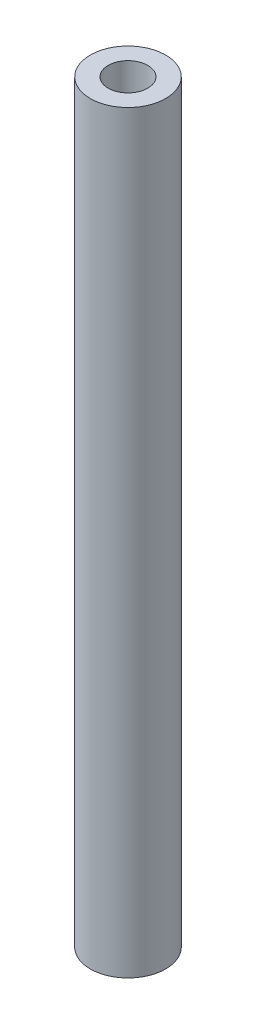
from build123d import *

# Parameters (mm, degrees)
BOSS_EXTRUDE1_DEPTH       = 80
BOSS_EXTRUDE1_DEPTH_BACK  = 0.0001
SKETCH1_R                 = 4
M5X0_8_TAPPED_HOLE1_D     = 4.2
M5X0_8_TAPPED_HOLE1_DEPTH = 14
M5X0_8_TAPPED_HOLE1_TIP   = 1.2618073
M5X0_8_TAPPED_HOLE2_D     = 4.2
M5X0_8_TAPPED_HOLE2_DEPTH = 14
M5X0_8_TAPPED_HOLE2_TIP   = 1.2618073


with BuildPart() as part:
    # Sketch1 → Boss-Extrude1 (new, two sides: drawn at the far end of the back side and taken through both)
    with BuildSketch(Plane(origin=(0, 0, 0), x_dir=(1, 0, 0), z_dir=(0, 1, 0)).offset(-BOSS_EXTRUDE1_DEPTH_BACK)):
        with Locations(Location((0, 0, 0), (0, 0, 270))):
            Circle(SKETCH1_R)
    extrude(amount=BOSS_EXTRUDE1_DEPTH + BOSS_EXTRUDE1_DEPTH_BACK)

    # M5x0.8 Tapped Hole1
    with Locations(Plane(origin=(0, 80, 0), x_dir=(1, 0, 0), z_dir=(0, 1, 0))):
        with Locations((0, 0)):
            Hole(M5X0_8_TAPPED_HOLE1_D / 2, depth=M5X0_8_TAPPED_HOLE1_DEPTH)
            with Locations((0, 0, -(M5X0_8_TAPPED_HOLE1_DEPTH + M5X0_8_TAPPED_HOLE1_TIP / 2))):  # 118° drill point
                Cone(0, M5X0_8_TAPPED_HOLE1_D / 2, M5X0_8_TAPPED_HOLE1_TIP, mode=Mode.SUBTRACT)

    # M5x0.8 Tapped Hole2
    with Locations(Plane(origin=(0, -0.0001, 0), x_dir=(-1, 0, 0), z_dir=(0, -1, 0))):
        with Locations((0, 0)):
            Hole(M5X0_8_TAPPED_HOLE2_D / 2, depth=M5X0_8_TAPPED_HOLE2_DEPTH)
            with Locations((0, 0, -(M5X0_8_TAPPED_HOLE2_DEPTH + M5X0_8_TAPPED_HOLE2_TIP / 2))):  # 118° drill point
                Cone(0, M5X0_8_TAPPED_HOLE2_D / 2, M5X0_8_TAPPED_HOLE2_TIP, mode=Mode.SUBTRACT)


solid = part.part
